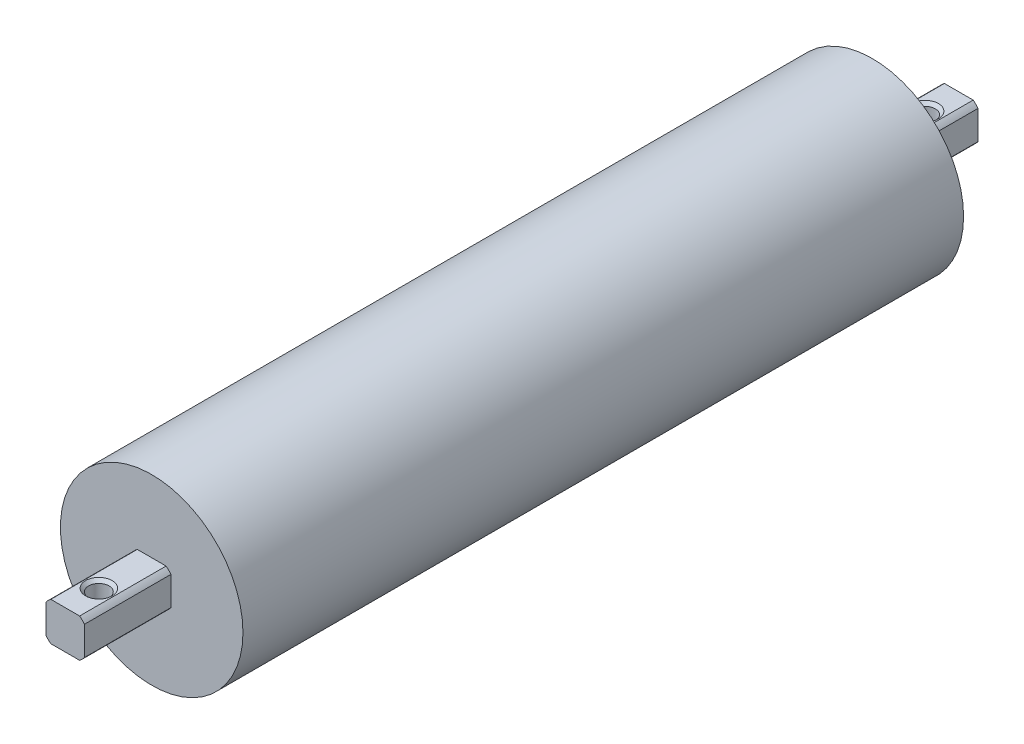
from build123d import *

# Parameters (mm, degrees)
SKETCH_1_R           = 38
EXTRUDE_1_DEPTH      = 150
SKETCH_2_R           = 10
EXTRUDE_2_DEPTH      = 36
SKETCH_3_OUTSIDE_W   = 148.554
SKETCH_3_OUTSIDE_H   = 148.554
SKETCH_3_OUTSIDE_W_2 = 16
SKETCH_3_OUTSIDE_H_2 = 16
CUT_EXTRUDE_1_DEPTH  = 36


with BuildPart() as part:
    # 草图1 → 凸台-拉伸1 (new, symmetric)
    with BuildSketch(Plane.XY):
        Circle(SKETCH_1_R)
    extrude(amount=EXTRUDE_1_DEPTH, both=True)

    # 草图2 → 凸台-拉伸2 (add)
    with BuildSketch(Plane.XY.offset(150)):
        Circle(SKETCH_2_R)
    extrude_2 = extrude(amount=EXTRUDE_2_DEPTH)

    # 草图3 outside → 切除-拉伸1 (cut)
    with BuildSketch(Plane.XY.offset(186)):
        Rectangle(SKETCH_3_OUTSIDE_W, SKETCH_3_OUTSIDE_H)
        Rectangle(SKETCH_3_OUTSIDE_W_2, SKETCH_3_OUTSIDE_H_2, mode=Mode.SUBTRACT)
    cut_extrude_1 = extrude(amount=-CUT_EXTRUDE_1_DEPTH, mode=Mode.SUBTRACT)

    # 草图5 → M10 螺纹孔1 (revolve, cut)
    with BuildSketch(Plane(origin=(0, 8, 172), x_dir=(0, 0, 1), z_dir=(1, 0, 0))):
        Polygon((0, 0), (0, 27.053657631), (4.25, 24.5), (4.25, 1.275), (5.525, 0), align=None)
    hole_wizard_m10_1 = revolve(axis=Axis((0, 14.35, 172), (0, -1, 0)), mode=Mode.SUBTRACT)

    # 镜向1: 凸台-拉伸2, 切除-拉伸1, M10 螺纹孔1 across plane
    add(extrude_2.mirror(Plane.XY))
    add(cut_extrude_1.mirror(Plane.XY), mode=Mode.SUBTRACT)
    add(hole_wizard_m10_1.mirror(Plane.XY), mode=Mode.SUBTRACT)


solid = part.part
